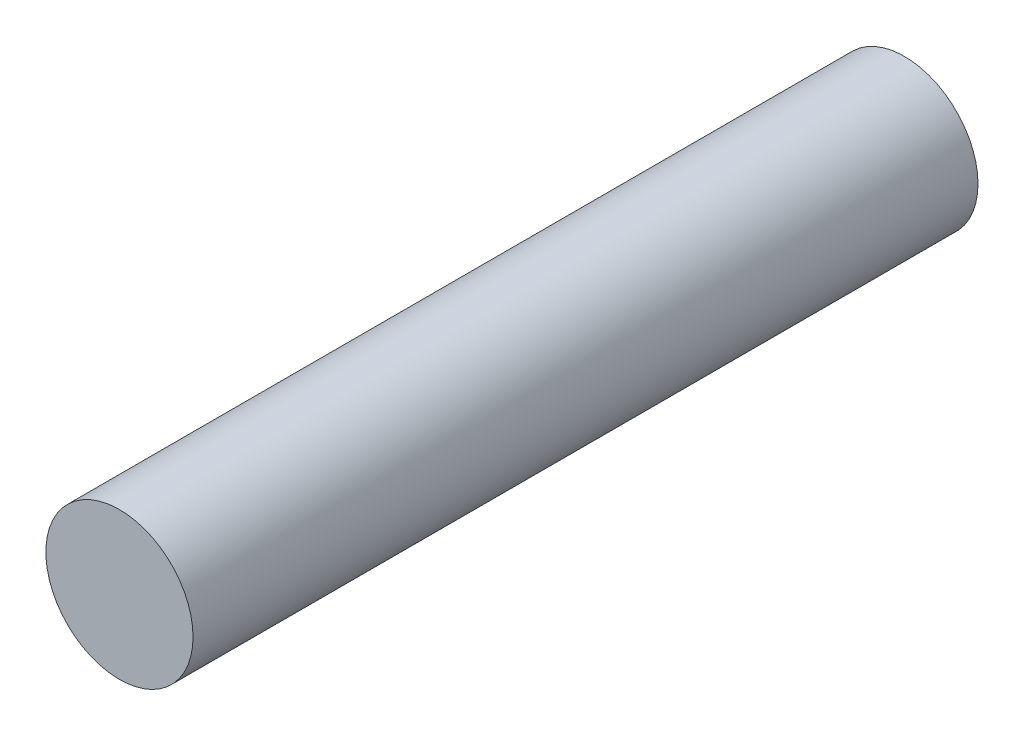
from build123d import *

# Parameters (mm, degrees)
SKETCH2_R           = 2.25
BOSS_EXTRUDE1_DEPTH = 24


with BuildPart() as part:
    # Sketch2 → Boss-Extrude1 (new body)
    with BuildSketch(Plane.XY):
        Circle(SKETCH2_R)
    extrude(amount=BOSS_EXTRUDE1_DEPTH)


solid = part.part
